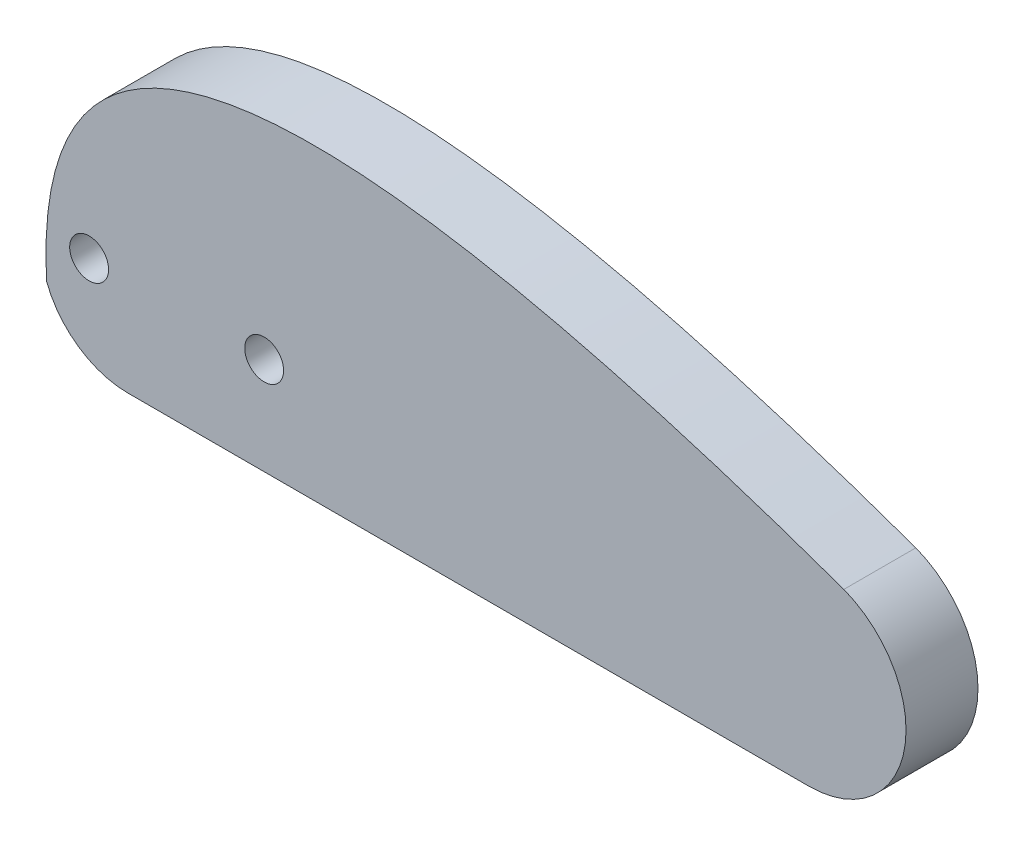
from build123d import *

# Parameters (mm, degrees)
SKETCH1_R           = 1
BOSS_EXTRUDE1_DEPTH = 3.7


with BuildPart() as part:
    # Sketch1 → Boss-Extrude1 (new body)
    with BuildSketch(Plane.XY):
        with BuildLine():
            Line((0, -5), (35, -5))
            ThreePointArc((35, -5), (39.915195567, -0.91698012), (36.802854648, 4.663658984))
            add(Edge.make_bspline(
                [(-4.182897753, -2.131172107), (-5.422528099, 19.74118681), (36.802854648, 4.663658984)],
                knots=[0, 0, 0, 1, 1, 1], degree=2))
            ThreePointArc((-4.182897753, -2.131172107), (-2.536080001, -4.213880968), (0, -5))
        make_face()
        with Locations((-2, 0)):
            Circle(SKETCH1_R, mode=Mode.SUBTRACT)
        with Locations((7, 0)):
            Circle(SKETCH1_R, mode=Mode.SUBTRACT)
    extrude(amount=BOSS_EXTRUDE1_DEPTH)


solid = part.part
